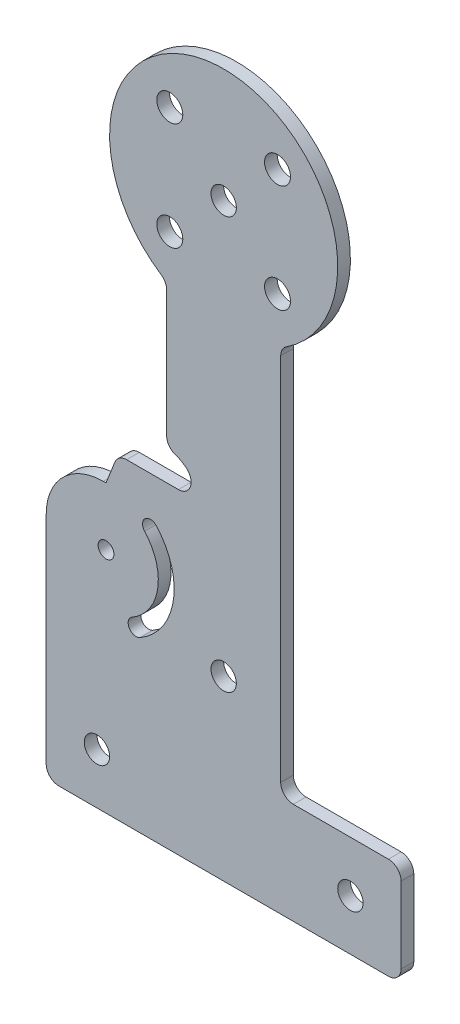
from build123d import *

# Parameters (mm, degrees)
SKETCH_1_R      = 2
SKETCH_1_R_2    = 2.05
SKETCH_1_R_3    = 1.25
EXTRUDE_1_DEPTH = 2
FILLET_1_R      = 2
FILLET_3_R      = 9


with BuildPart() as part:
    # 草图1 → 凸台-拉伸1 (new body)
    with BuildSketch(Plane.XY):
        with BuildLine():
            Line((14.659550972, 15.317683161), (14.659550972, 31.317683161))
            Line((14.659550972, 31.317683161), (-4.340449028, 31.317683161))
            Line((-4.340449028, 31.317683161), (-4.340449028, 92.729225893))
            ThreePointArc((-4.340449028, 92.729225893), (-13.340449028, 126.317683161), (-22.340449028, 92.729225893))
            Line((-22.340449028, 92.729225893), (-22.340449028, 69.989347616))
            ThreePointArc((-22.340449028, 69.989347616), (-18.993837092, 68.603135564), (-17.60762504, 65.256523627))
            Line((-17.60762504, 65.256523627), (-30.009910092, 65.256523627))
            Line((-30.009910092, 65.256523627), (-31.902307309, 60.456523627))
            Line((-31.902307309, 60.456523627), (-41.340449028, 60.456523627))
            Line((-41.340449028, 60.456523627), (-41.340449028, 31.317683161))
            Line((-41.340449028, 31.317683161), (-41.340449028, 15.317683161))
            Line((-41.340449028, 15.317683161), (14.659550972, 15.317683161))
        make_face()
        with Locations((-33.340449028, 23.317683161)):
            Circle(SKETCH_1_R, mode=Mode.SUBTRACT)
        with Locations(Location((6.659550972, 23.317683161, 0), (0, 0, 180))):
            Circle(SKETCH_1_R, mode=Mode.SUBTRACT)
        with Locations((-13.340449028, 108.317683161)):
            Circle(SKETCH_1_R, mode=Mode.SUBTRACT)
        with Locations((-13.340449028, 43.317683161)):
            Circle(SKETCH_1_R, mode=Mode.SUBTRACT)
        with Locations((-4.840449028, 116.817683161)):
            Circle(SKETCH_1_R_2, mode=Mode.SUBTRACT)
        with Locations((-31.902307309, 51.317683161)):
            Circle(SKETCH_1_R_3, mode=Mode.SUBTRACT)
        with Locations((-4.840449028, 99.817683161)):
            Circle(SKETCH_1_R_2, mode=Mode.SUBTRACT)
        with Locations((-21.840449028, 99.817683161)):
            Circle(SKETCH_1_R_2, mode=Mode.SUBTRACT)
        with Locations((-21.840449028, 116.817683161)):
            Circle(SKETCH_1_R_2, mode=Mode.SUBTRACT)
        with BuildLine():
            ThreePointArc((-26.536162252, 42.002803279), (-21.278560655, 49.674969847), (-23.973383464, 58.576792381))
            ThreePointArc((-23.973383464, 58.576792381), (-25.73943382, 58.654677802), (-25.817319241, 56.888627446))
            ThreePointArc((-25.817319241, 56.888627446), (-23.749199411, 50.056996199), (-27.784102963, 44.169054414))
            ThreePointArc((-27.784102963, 44.169054414), (-28.243258175, 42.461958491), (-26.536162252, 42.002803279))
        make_face(mode=Mode.SUBTRACT)
    extrude(amount=EXTRUDE_1_DEPTH)

    # 圆角1
    fillet_1_edges = [part.edges().sort_by_distance(p)[0] for p in [
        (-41.340449028, 15.317683161, 1),
        (-30.009910092, 65.256523627, 1),
        (-17.60762504, 65.256523627, 1),
        (-22.340449028, 69.989347616, 1),
        (-22.340449028, 92.729225893, 1),
        (-4.340449028, 92.729225893, 1),
        (-4.340449028, 31.317683161, 1),
        (14.659550972, 31.317683161, 1),
        (14.659550972, 15.317683161, 1),
    ]]
    fillet(fillet_1_edges, radius=FILLET_1_R)

    # 圆角3
    fillet_3_edges = [part.edges().sort_by_distance(p)[0] for p in [
        (-41.340449028, 60.456523627, 1),
    ]]
    fillet(fillet_3_edges, radius=FILLET_3_R)


solid = part.part
